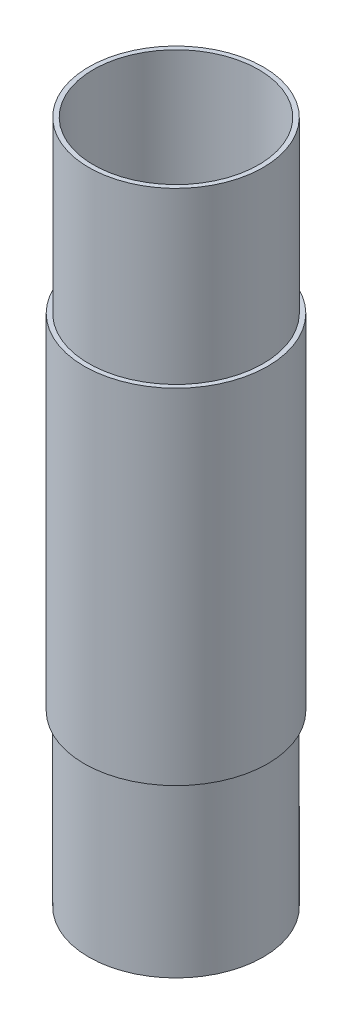
from build123d import *

# Parameters (mm, degrees)
SKETCH1_R           = 40
SKETCH1_R_2         = 37
EXTRUDE_THIN1_DEPTH = 150
SKETCH2_R           = 38
SKETCH2_R_2         = 36
EXTRUDE_THIN2_DEPTH = 74
SKETCH7_R           = 38
SKETCH7_R_2         = 37
EXTRUDE_THIN7_DEPTH = 74
SKETCH4_R           = 38
SKETCH4_R_2         = 36
BOSS_EXTRUDE2_DEPTH = 224


with BuildPart() as part:
    # Sketch1 → Extrude-Thin1 (new body)
    with BuildSketch(Plane(origin=(0, 0, 0), x_dir=(1, 0, 0), z_dir=(0, 1, 0))):
        Circle(SKETCH1_R)
        Circle(SKETCH1_R_2, mode=Mode.SUBTRACT)
    extrude(amount=EXTRUDE_THIN1_DEPTH)



with BuildPart() as body_2:
    # Sketch2 → Extrude-Thin2 (new body)
    with BuildSketch(Plane.XZ):
        Circle(SKETCH2_R)
        Circle(SKETCH2_R_2, mode=Mode.SUBTRACT)
    extrude(amount=EXTRUDE_THIN2_DEPTH)


with BuildPart() as body_3:
    # Sketch7 → Extrude-Thin7 (new body)
    with BuildSketch(Plane(origin=(0, 150, 0), x_dir=(1, 0, 0), z_dir=(0, 1, 0))):
        Circle(SKETCH7_R)
        Circle(SKETCH7_R_2, mode=Mode.SUBTRACT)
    extrude(amount=EXTRUDE_THIN7_DEPTH)


with BuildPart() as part_1:
    add(part.part)

    add(body_2.part)  # Boss-Extrude2 merges body 2

    add(body_3.part)  # Boss-Extrude2 merges body 3
    # Sketch4 → Boss-Extrude2 (add, through all)
    with BuildSketch(Plane(origin=(0, 0, 0), x_dir=(1, 0, 0), z_dir=(0, 1, 0))):
        with Locations(Location((0, 0, 0), (0, 0, 90))):
            Circle(SKETCH4_R)
        with Locations(Location((0, 0, 0), (0, 0, 90))):
            Circle(SKETCH4_R_2, mode=Mode.SUBTRACT)
    extrude(amount=BOSS_EXTRUDE2_DEPTH)


solid = part_1.part
